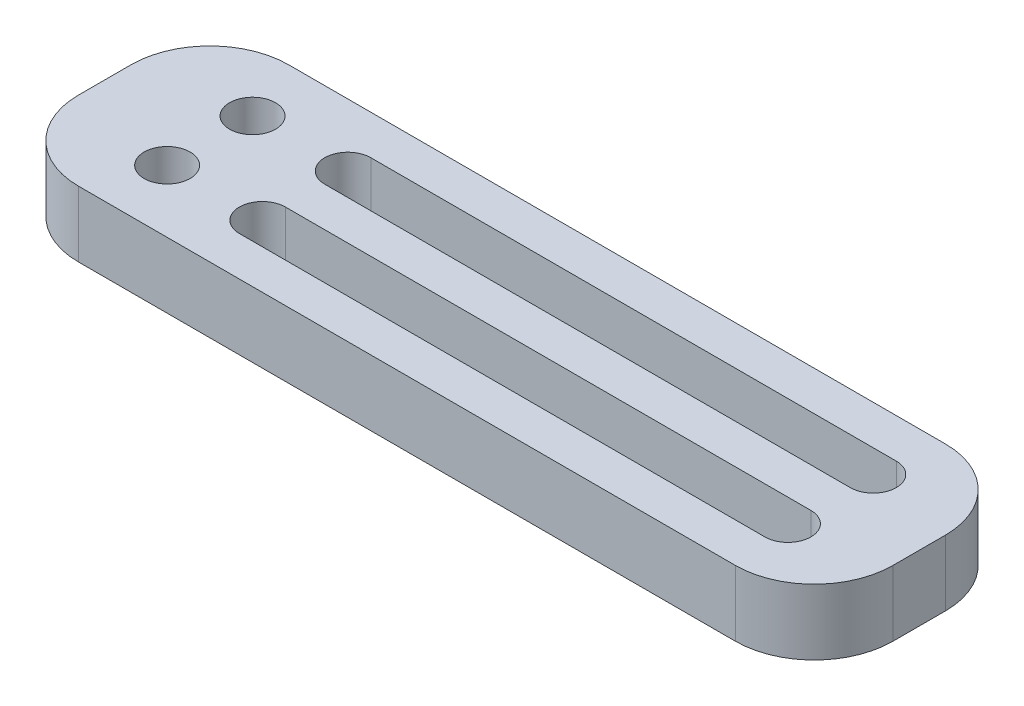
from build123d import *

# Parameters (mm, degrees)
SKETCH1_R           = 1.75
BOSS_EXTRUDE1_DEPTH = 5


with BuildPart() as part:
    # Sketch1 → Boss-Extrude1 (new body)
    with BuildSketch(Plane(origin=(0, 0, 0), x_dir=(1, 0, 0), z_dir=(0, 1, 0))):
        with BuildLine():
            Line((6, 6), (56, 6))
            ThreePointArc((56, 6), (60.242640687, 4.242640687), (62, 0))
            Line((62, 0), (62, -4))
            ThreePointArc((62, -4), (60.242640687, -8.242640687), (56, -10))
            Line((56, -10), (6, -10))
            ThreePointArc((6, -10), (1.757359313, -8.242640687), (0, -4))
            Line((0, -4), (0, 0))
            ThreePointArc((0, 0), (1.757359313, 4.242640687), (6, 6))
        make_face()
        with Locations(Location((8, 1.25, 0), (0, 0, 270))):
            Circle(SKETCH1_R, mode=Mode.SUBTRACT)
        with Locations(Location((8, -5.25, 0), (0, 0, 90))):
            Circle(SKETCH1_R, mode=Mode.SUBTRACT)
        with BuildLine():
            Line((15.25, -7), (55.25, -7))
            ThreePointArc((55.25, -7), (57, -5.25), (55.25, -3.5))
            Line((55.25, -3.5), (15.25, -3.5))
            ThreePointArc((15.25, -3.5), (13.5, -5.25), (15.25, -7))
        make_face(mode=Mode.SUBTRACT)
        with BuildLine():
            Line((15.25, 3), (55.25, 3))
            ThreePointArc((55.25, 3), (57, 1.25), (55.25, -0.5))
            Line((55.25, -0.5), (15.25, -0.5))
            ThreePointArc((15.25, -0.5), (13.5, 1.25), (15.25, 3))
        make_face(mode=Mode.SUBTRACT)
    extrude(amount=-BOSS_EXTRUDE1_DEPTH)


solid = part.part
